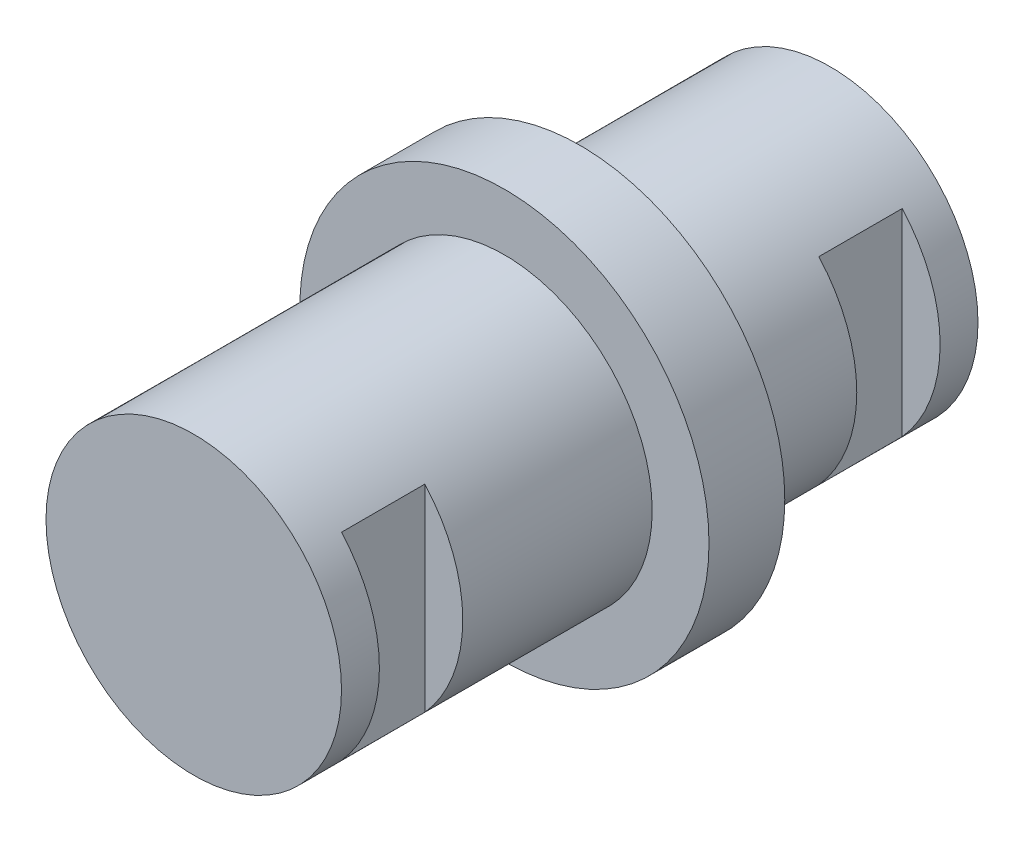
from build123d import *

# Parameters (mm, degrees)
SKETCH1_R               = 4.953
BOSS_EXTRUDE1_DEPTH     = 21.336
BOSS_EXTRUDE2_START     = -10.414
SKETCH2_R               = 6.858
BOSS_EXTRUDE2_DEPTH     = 2.54
CUT_EXTRUDE1_DEPTH      = 24.436920105
CUT_EXTRUDE1_DEPTH_BACK = 24.436920105
SKETCH3_W               = 1.27
SKETCH3_H               = 2.794
CUT_EXTRUDE2_DEPTH      = 24.436920105
CUT_EXTRUDE2_DEPTH_BACK = 24.436920105
SKETCH4_W               = 1.27
SKETCH4_H               = 2.794


with BuildPart() as part:
    # Sketch1 → Boss-Extrude1 (new body)
    with BuildSketch(Plane.XY):
        Circle(SKETCH1_R)
    extrude(amount=BOSS_EXTRUDE1_DEPTH)

    # Sketch2 → Boss-Extrude2 (add)
    with BuildSketch(Plane.XY.offset(21.336).offset(BOSS_EXTRUDE2_START)):
        Circle(SKETCH2_R)
    extrude(amount=-BOSS_EXTRUDE2_DEPTH)

    # Sketch3 → Cut-Extrude1 (cut, two sides: drawn at the far end of the back side and taken through both)
    with BuildSketch(Plane(origin=(0, 0, 0), x_dir=(1, 0, 0), z_dir=(0, 1, 0)).offset(-CUT_EXTRUDE1_DEPTH_BACK)):
        with Locations((4.318, -2.667)):
            Rectangle(SKETCH3_W, SKETCH3_H)
        with Locations((-4.318, -2.667)):
            Rectangle(SKETCH3_W, SKETCH3_H)
    extrude(amount=CUT_EXTRUDE1_DEPTH + CUT_EXTRUDE1_DEPTH_BACK, mode=Mode.SUBTRACT)

    # Sketch4 → Cut-Extrude2 (cut, two sides: drawn at the far end of the back side and taken through both)
    with BuildSketch(Plane(origin=(0, 0, 0), x_dir=(1, 0, 0), z_dir=(0, 1, 0)).offset(-CUT_EXTRUDE2_DEPTH_BACK)):
        with Locations((4.318, -18.669)):
            Rectangle(SKETCH4_W, SKETCH4_H)
        with Locations((-4.318, -18.669)):
            Rectangle(SKETCH4_W, SKETCH4_H)
    extrude(amount=CUT_EXTRUDE2_DEPTH + CUT_EXTRUDE2_DEPTH_BACK, mode=Mode.SUBTRACT)


solid = part.part
